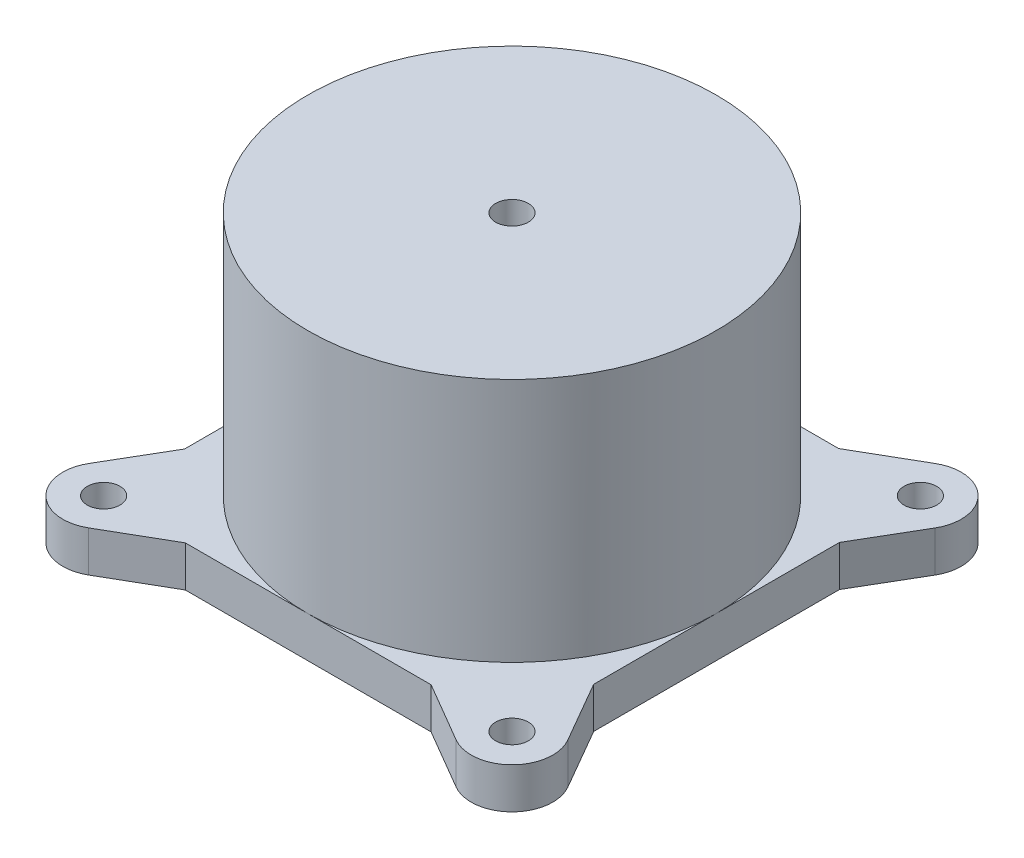
from build123d import *

# Parameters (mm, degrees)
SKETCH1_R           = 50
SKETCH1_R_2         = 4
BOSS_EXTRUDE1_DEPTH = 10
BOSS_EXTRUDE2_START = 50
SKETCH2_R           = 50
SKETCH2_R_2         = 40
BOSS_EXTRUDE2_DEPTH = 50
BOSS_EXTRUDE3_START = 10
SKETCH4_R           = 4
SKETCH4_R_2         = 40
BOSS_EXTRUDE3_DEPTH = 10


with BuildPart() as part:
    # Sketch1 → Boss-Extrude1 (new body)
    with BuildSketch(Plane(origin=(0, 0, 0), x_dir=(1, 0, 0), z_dir=(0, 1, 0))):
        with Locations(Location((0, 0, 0), (0, 0, 270))):
            Circle(SKETCH1_R)
        with Locations(Location((0, 0, 0), (0, 0, 270))):
            Circle(SKETCH1_R_2, mode=Mode.SUBTRACT)
    extrude(amount=BOSS_EXTRUDE1_DEPTH)

    # Sketch2 → Boss-Extrude2 (add)
    with BuildSketch(Plane.XZ.offset(BOSS_EXTRUDE2_START)):
        with Locations(Location((0, 0, 0), (0, 0, 270))):
            Circle(SKETCH2_R)
        with Locations(Location((0, 0, 0), (0, 0, 270))):
            Circle(SKETCH2_R_2, mode=Mode.SUBTRACT)
    extrude(amount=-BOSS_EXTRUDE2_DEPTH)

    # Sketch4 → Boss-Extrude3 (add)
    with BuildSketch(Plane.XZ.offset(50).offset(BOSS_EXTRUDE3_START)):
        with BuildLine():
            Line((-30.18665216, -50), (29.99743133, -50))
            Line((29.99743133, -50), (45.000642085, -58.660624714))
            ThreePointArc((45.000642085, -58.660624714), (57.090562914, -57.051518812), (58.632887989, -44.95289737))
            Line((58.632887989, -44.95289737), (50, -30.18665216))
            Line((50, -30.18665216), (50, 29.99743133))
            Line((50, 29.99743133), (58.660624714, 45.000642085))
            ThreePointArc((58.660624714, 45.000642085), (57.051518812, 57.090562914), (44.95289737, 58.632887989))
            Line((44.95289737, 58.632887989), (30.18665216, 50))
            Line((30.18665216, 50), (-29.99743133, 50))
            Line((-29.99743133, 50), (-45.000642085, 58.660624714))
            ThreePointArc((-45.000642085, 58.660624714), (-57.090562914, 57.051518812), (-58.632887989, 44.95289737))
            Line((-58.632887989, 44.95289737), (-50, 30.18665216))
            Line((-50, 30.18665216), (-50, -29.99743133))
            Line((-50, -29.99743133), (-58.660624714, -45.000642085))
            ThreePointArc((-58.660624714, -45.000642085), (-57.051518812, -57.090562914), (-44.95289737, -58.632887989))
            Line((-44.95289737, -58.632887989), (-30.18665216, -50))
        make_face()
        with Locations(Location((-50, 50, 0), (0, 0, 270))):
            Circle(SKETCH4_R, mode=Mode.SUBTRACT)
        with Locations(Location((-50, -50, 0), (0, 0, 270))):
            Circle(SKETCH4_R, mode=Mode.SUBTRACT)
        with Locations(Location((50, -50, 0), (0, 0, 90))):
            Circle(SKETCH4_R, mode=Mode.SUBTRACT)
        with Locations(Location((50, 50, 0), (0, 0, 90))):
            Circle(SKETCH4_R, mode=Mode.SUBTRACT)
        with Locations(Location((0, 0, 0), (0, 0, 270))):
            Circle(SKETCH4_R_2, mode=Mode.SUBTRACT)
    extrude(amount=-BOSS_EXTRUDE3_DEPTH)


solid = part.part
